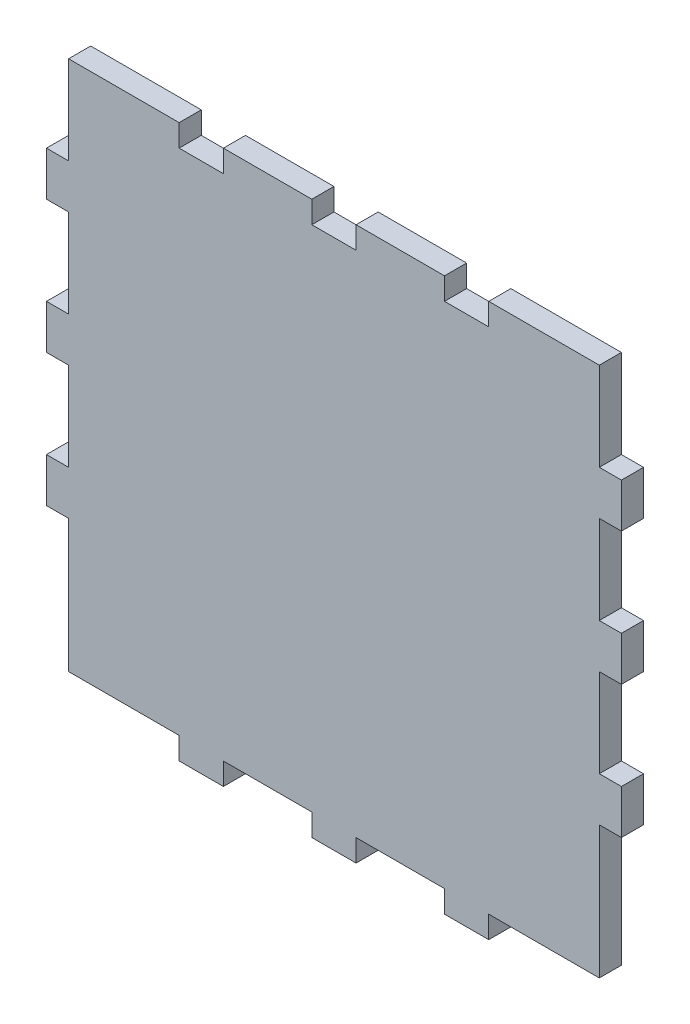
from build123d import *

# Parameters (mm, degrees)
BOSS_EXTRUDE1_DEPTH = 5


with BuildPart() as part:
    # Sketch1 → Boss-Extrude1 (new body)
    with BuildSketch(Plane.XY):
        Polygon((-35, 60), (-35, 55), (-25, 55), (-25, 60), (-5, 60), (-5, 55), (5, 55), (5, 60), (25, 60), (25, 55), (35, 55), (35, 60), (60, 60), (60, 40), (65, 40), (65, 30), (60, 30), (60, 10), (65, 10), (65, 0), (60, 0), (60, -20), (65, -20), (65, -30), (60, -30), (60, -60), (35, -60), (35, -65), (25, -65), (25, -60), (5, -60), (5, -65), (-5, -65), (-5, -60), (-25, -60), (-25, -65), (-35, -65), (-35, -60), (-60, -60), (-60, -30), (-65, -30), (-65, -20), (-60, -20), (-60, 0), (-65, 0), (-65, 10), (-60, 10), (-60, 30), (-65, 30), (-65, 40), (-60, 40), (-60, 60), align=None)
    extrude(amount=BOSS_EXTRUDE1_DEPTH)


solid = part.part
